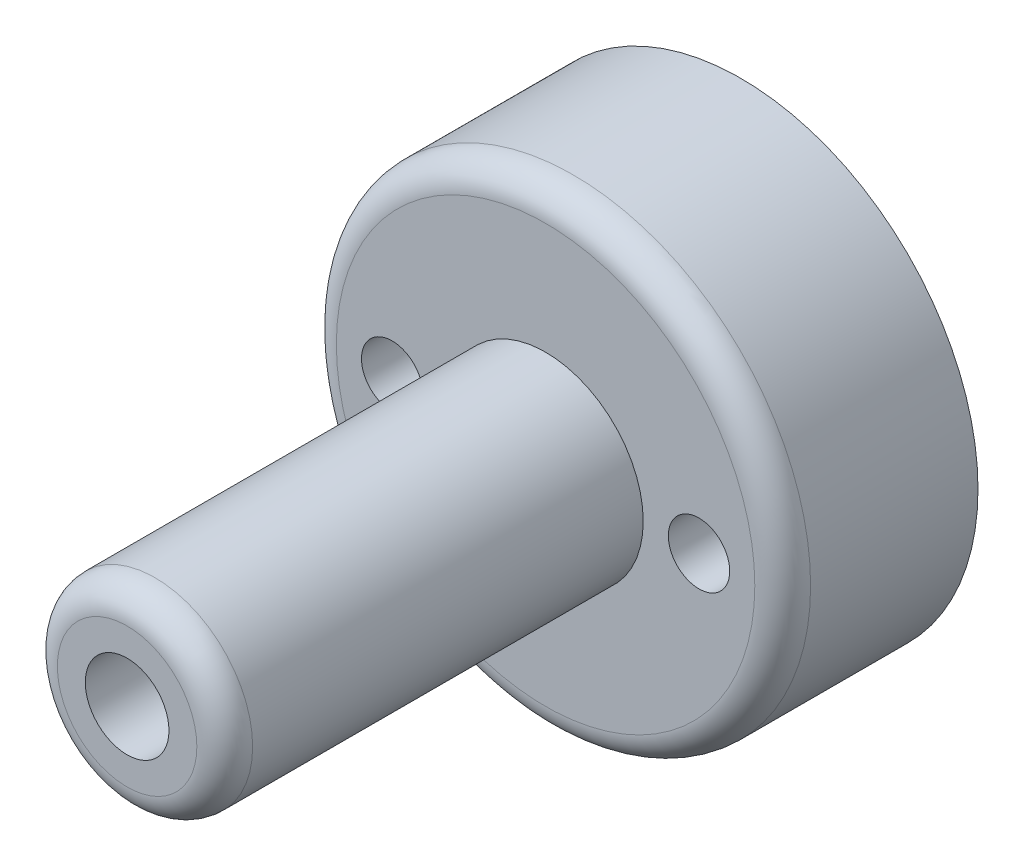
from build123d import *

# Parameters (mm, degrees)
SKETCH1_R               = 8.5
SKETCH1_R_2             = 7.55
BOSS_EXTRUDE1_DEPTH     = 5
SKETCH2_R               = 8.5
SKETCH2_R_2             = 1.1
BOSS_EXTRUDE2_DEPTH     = 2
SKETCH3_R               = 3.5
SKETCH3_R_2             = 1.5
BOSS_EXTRUDE3_DEPTH     = 15
CUT_EXTRUDE1_DEPTH      = 20.222382787
CUT_EXTRUDE1_DEPTH_BACK = 20.222382787
SKETCH3_3_R             = 1.1
SKETCH4_R               = 1.6
SKETCH4_R_2             = 1.1
BOSS_EXTRUDE4_DEPTH     = 5
BOSS_EXTRUDE5_START     = -0.3
SKETCH5_R               = 1.1
BOSS_EXTRUDE5_DEPTH     = 0.3
FILLET1_R               = 1


with BuildPart() as part:
    # Sketch1 → Boss-Extrude1 (new body)
    with BuildSketch(Plane.XY):
        Circle(SKETCH1_R)
        Circle(SKETCH1_R_2, mode=Mode.SUBTRACT)
    extrude(amount=BOSS_EXTRUDE1_DEPTH)

    # Sketch2 → Boss-Extrude2 (add)
    with BuildSketch(Plane.XY.offset(5)):
        Circle(SKETCH2_R)
        Circle(SKETCH2_R_2, mode=Mode.SUBTRACT)
    extrude(amount=BOSS_EXTRUDE2_DEPTH)

    # Sketch3 → Boss-Extrude3 (add)
    with BuildSketch(Plane.XY.offset(7)):
        Circle(SKETCH3_R)
        Circle(SKETCH3_R_2, mode=Mode.SUBTRACT)
    extrude(amount=BOSS_EXTRUDE3_DEPTH)

    # Sketch3<3> → Cut-Extrude1 (cut, two sides: drawn at the far end of the back side and taken through both)
    with BuildSketch(Plane.XY.offset(7).offset(-CUT_EXTRUDE1_DEPTH_BACK)):
        with Locations((-5.5, 0)):
            Circle(SKETCH3_3_R)
        with Locations((5.5, 0)):
            Circle(SKETCH3_3_R)
    extrude(amount=CUT_EXTRUDE1_DEPTH + CUT_EXTRUDE1_DEPTH_BACK, mode=Mode.SUBTRACT)

    # Sketch4 → Boss-Extrude4 (add)
    # profile 1 of 3: a face of its own
    with BuildSketch(Plane(origin=(0, 0, 5), x_dir=(-1, 0, 0), z_dir=(0, 0, -1))):
        with Locations(Location((5.5, 0, 0), (0, 0, 180))):
            Circle(SKETCH4_R)
        with Locations(Location((5.5, 0, 0), (0, 0, 180))):
            Circle(SKETCH4_R_2, mode=Mode.SUBTRACT)
    # profile 2 of 3: a face of its own
    with BuildSketch(Plane(origin=(0, 0, 5), x_dir=(-1, 0, 0), z_dir=(0, 0, -1))):
        with Locations(Location((0, 0, 0), (0, 0, 180))):
            Circle(SKETCH4_R)
        with Locations(Location((0, 0, 0), (0, 0, 180))):
            Circle(SKETCH4_R_2, mode=Mode.SUBTRACT)
    # profile 3 of 3: a face of its own
    with BuildSketch(Plane(origin=(0, 0, 5), x_dir=(-1, 0, 0), z_dir=(0, 0, -1))):
        with Locations(Location((-5.5, 0, 0), (0, 0, 180))):
            Circle(SKETCH4_R)
        with Locations(Location((-5.5, 0, 0), (0, 0, 180))):
            Circle(SKETCH4_R_2, mode=Mode.SUBTRACT)
    extrude(amount=BOSS_EXTRUDE4_DEPTH)

    # Sketch5 → Boss-Extrude5 (add)
    with BuildSketch(Plane(origin=(0, 0, 5), x_dir=(-1, 0, 0), z_dir=(0, 0, -1)).offset(BOSS_EXTRUDE5_START)):
        with Locations(Location((5.5, 0, 0), (0, 0, 180))):
            Circle(SKETCH5_R)
        with Locations(Location((-5.5, 0, 0), (0, 0, 180))):
            Circle(SKETCH5_R)
        Circle(SKETCH5_R)
    extrude(amount=BOSS_EXTRUDE5_DEPTH)

    # Fillet1
    fillet1_edges = [part.edges().sort_by_distance(p)[0] for p in [
        (-8.5, 0, 7),
        (-3.5, 0, 22),
    ]]
    fillet(fillet1_edges, radius=FILLET1_R)


solid = part.part
